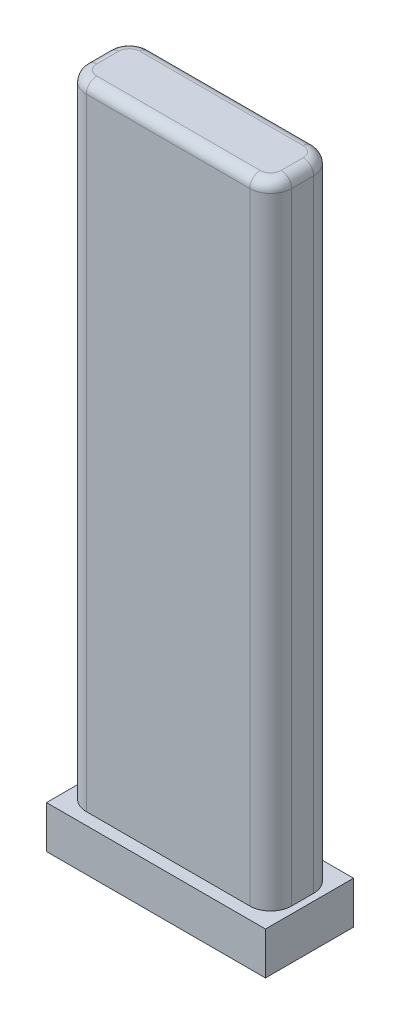
from build123d import *

# Parameters (mm, degrees)
BOSS_EXTRUDE1_DEPTH = 60.3
SKETCH2_W           = 20.9
SKETCH2_H           = 8.4
BOSS_EXTRUDE2_DEPTH = 4.55
FILLET1_R           = 1
CHAMFER1_SIZE       = 0.5


with BuildPart() as part:
    # Sketch1 → Boss-Extrude1 (new body)
    with BuildSketch(Plane(origin=(0, 0, 0), x_dir=(1, 0, 0), z_dir=(0, 1, 0))):
        with BuildLine():
            Line((-7.8, 3.05), (7.8, 3.05))
            ThreePointArc((7.8, 3.05), (9.214213562, 2.464213562), (9.8, 1.05))
            Line((9.8, 1.05), (9.8, -1.05))
            ThreePointArc((9.8, -1.05), (9.214213562, -2.464213562), (7.8, -3.05))
            Line((7.8, -3.05), (-7.8, -3.05))
            ThreePointArc((-7.8, -3.05), (-9.214213562, -2.464213562), (-9.8, -1.05))
            Line((-9.8, -1.05), (-9.8, 1.05))
            ThreePointArc((-9.8, 1.05), (-9.214213562, 2.464213562), (-7.8, 3.05))
        make_face()
    extrude(amount=BOSS_EXTRUDE1_DEPTH)

    # Sketch2 → Boss-Extrude2 (add)
    with BuildSketch(Plane(origin=(0, 0, 0), x_dir=(1, 0, 0), z_dir=(0, 1, 0))):
        Rectangle(SKETCH2_W, SKETCH2_H)
    extrude(amount=-BOSS_EXTRUDE2_DEPTH)

    # Fillet1
    fillet1_edges = [part.edges().sort_by_distance(p)[0] for p in [
        (9.214213562, 60.3, -2.464213562),
        (0, 60.3, -3.05),
        (-9.214213562, 60.3, -2.464213562),
        (-9.8, 60.3, 0),
        (-9.214213562, 60.3, 2.464213562),
        (0, 60.3, 3.05),
        (9.214213562, 60.3, 2.464213562),
        (9.8, 60.3, 0),
    ]]
    fillet(fillet1_edges, radius=FILLET1_R)

    # Chamfer1
    chamfer1_edges = [part.edges().sort_by_distance(p)[0] for p in [
        (10.45, -4.55, 0),
        (0, -4.55, 4.2),
        (-10.45, -4.55, 0),
        (0, -4.55, -4.2),
    ]]
    chamfer(chamfer1_edges, length=CHAMFER1_SIZE)


solid = part.part
